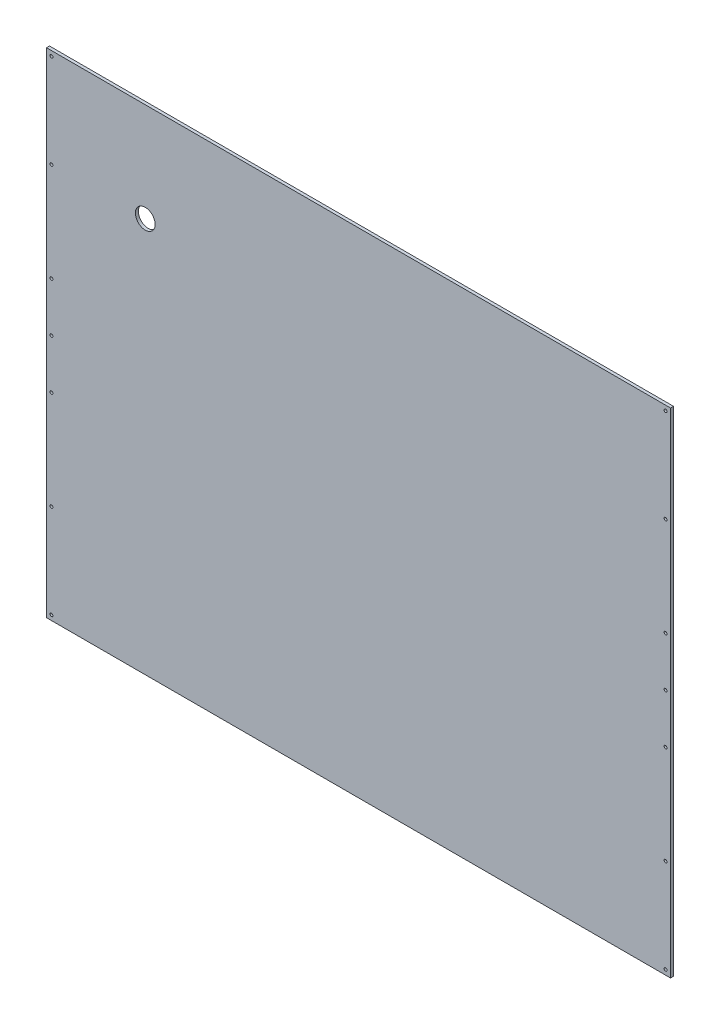
from build123d import *

# Parameters (mm, degrees)
SKETCH_1_W      = 632
SKETCH_1_H      = 500
SKETCH_1_R      = 1.5
SKETCH_1_R_2    = 10
EXTRUDE_1_DEPTH = 3


with BuildPart() as part:
    # 草图1 → 凸台-拉伸1 (new body)
    with BuildSketch(Plane.XY):
        with Locations((316, 250)):
            Rectangle(SKETCH_1_W, SKETCH_1_H)
        with Locations((627, 250)):
            Circle(SKETCH_1_R, mode=Mode.SUBTRACT)
        with Locations((627, 300)):
            Circle(SKETCH_1_R, mode=Mode.SUBTRACT)
        with Locations((627, 400)):
            Circle(SKETCH_1_R, mode=Mode.SUBTRACT)
        with Locations((627, 495)):
            Circle(SKETCH_1_R, mode=Mode.SUBTRACT)
        with Locations(Location((627, 5, 0), (0, 0, 180))):
            Circle(SKETCH_1_R, mode=Mode.SUBTRACT)
        with Locations(Location((627, 100, 0), (0, 0, 180))):
            Circle(SKETCH_1_R, mode=Mode.SUBTRACT)
        with Locations(Location((627, 200, 0), (0, 0, 180))):
            Circle(SKETCH_1_R, mode=Mode.SUBTRACT)
        with Locations((5, 200)):
            Circle(SKETCH_1_R, mode=Mode.SUBTRACT)
        with Locations((5, 100)):
            Circle(SKETCH_1_R, mode=Mode.SUBTRACT)
        with Locations((5, 5)):
            Circle(SKETCH_1_R, mode=Mode.SUBTRACT)
        with Locations(Location((5, 495, 0), (0, 0, 180))):
            Circle(SKETCH_1_R, mode=Mode.SUBTRACT)
        with Locations(Location((5, 400, 0), (0, 0, 180))):
            Circle(SKETCH_1_R, mode=Mode.SUBTRACT)
        with Locations(Location((5, 300, 0), (0, 0, 180))):
            Circle(SKETCH_1_R, mode=Mode.SUBTRACT)
        with Locations(Location((5, 250, 0), (0, 0, 180))):
            Circle(SKETCH_1_R, mode=Mode.SUBTRACT)
        with Locations((100, 400)):
            Circle(SKETCH_1_R_2, mode=Mode.SUBTRACT)
    extrude(amount=EXTRUDE_1_DEPTH)


solid = part.part
